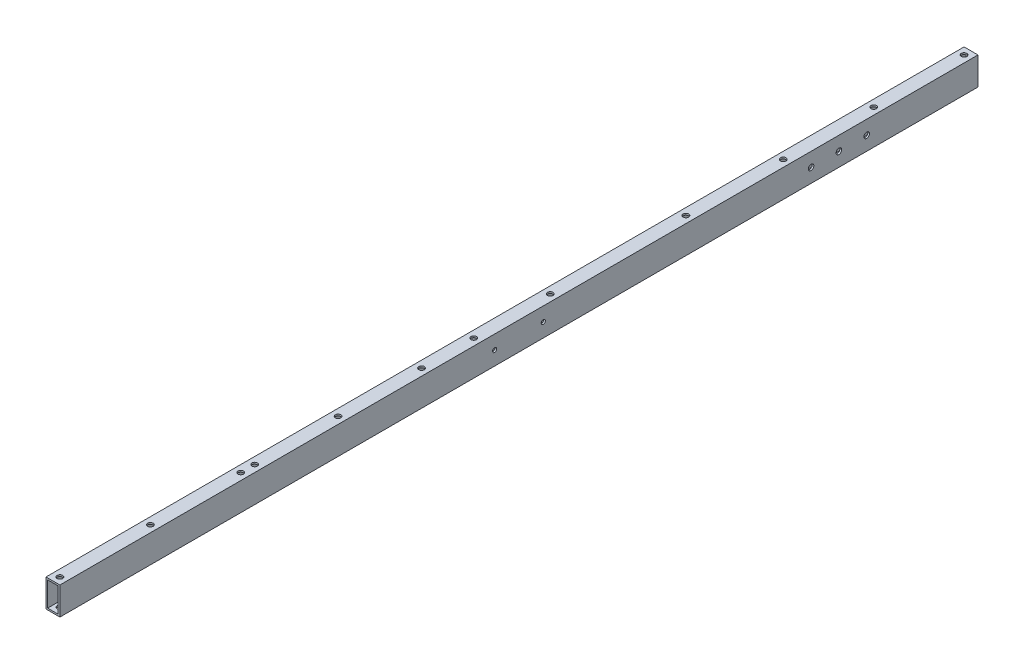
from build123d import *

# Parameters (mm, degrees)
SKETCH_1_W          = 10
SKETCH_1_H          = 20
SKETCH_1_W_2        = 7.6
SKETCH_1_H_2        = 17.6
EXTRUDE_1_DEPTH     = 660
SKETCH_2_R          = 2
CUT_EXTRUDE_1_DEPTH = 661.321891202
SKETCH_3_R          = 1.5
SKETCH_3_R_2        = 2
CUT_EXTRUDE_2_DEPTH = 661.151497764


with BuildPart() as part:
    # ｽｹｯﾁ1 → 押し出し-薄板1 (new body)
    with BuildSketch(Plane.XY):
        Rectangle(SKETCH_1_W, SKETCH_1_H)
        Rectangle(SKETCH_1_W_2, SKETCH_1_H_2, mode=Mode.SUBTRACT)
    extrude(amount=EXTRUDE_1_DEPTH)

    # ｽｹｯﾁ2 → ｶｯﾄ - 押し出し1 (cut, through all)
    with BuildSketch(Plane(origin=(0, 10, 0), x_dir=(1, 0, 0), z_dir=(0, 1, 0))):
        with Locations(Location((0, -525, 0), (0, 0, 270))):
            Circle(SKETCH_2_R)
        with Locations(Location((0, -655, 0), (0, 0, 270))):
            Circle(SKETCH_2_R)
        with Locations(Location((0, -590, 0), (0, 0, 270))):
            Circle(SKETCH_2_R)
        with Locations(Location((0, -5, 0), (0, 0, 270))):
            Circle(SKETCH_2_R)
        with Locations(Location((0, -70, 0), (0, 0, 270))):
            Circle(SKETCH_2_R)
        with Locations(Location((0, -135, 0), (0, 0, 270))):
            Circle(SKETCH_2_R)
        with Locations(Location((0, -515, 0), (0, 0, 270))):
            Circle(SKETCH_2_R)
        with Locations(Location((0, -357.5, 0), (0, 0, 270))):
            Circle(SKETCH_2_R)
        with Locations(Location((0, -302.5, 0), (0, 0, 270))):
            Circle(SKETCH_2_R)
        with Locations(Location((0, -395, 0), (0, 0, 270))):
            Circle(SKETCH_2_R)
        with Locations(Location((0, -455, 0), (0, 0, 270))):
            Circle(SKETCH_2_R)
        with Locations(Location((0, -205, 0), (0, 0, 270))):
            Circle(SKETCH_2_R)
    extrude(amount=-CUT_EXTRUDE_1_DEPTH, mode=Mode.SUBTRACT)

    # ｽｹｯﾁ3 → ｶｯﾄ - 押し出し2 (cut, through all)
    with BuildSketch(Plane(origin=(5, 0, 0), x_dir=(0, 0, -1), z_dir=(1, 0, 0))):
        with Locations(Location((-312.5, 0, 0), (0, 0, 90))):
            Circle(SKETCH_3_R)
        with Locations(Location((-347.5, 0, 0), (0, 0, 90))):
            Circle(SKETCH_3_R)
        with Locations(Location((-100, 0, 0), (0, 0, 90))):
            Circle(SKETCH_3_R_2)
        with Locations(Location((-80, 0, 0), (0, 0, 90))):
            Circle(SKETCH_3_R_2)
        with Locations(Location((-120, 0, 0), (0, 0, 90))):
            Circle(SKETCH_3_R_2)
    extrude(amount=-CUT_EXTRUDE_2_DEPTH, mode=Mode.SUBTRACT)


solid = part.part
